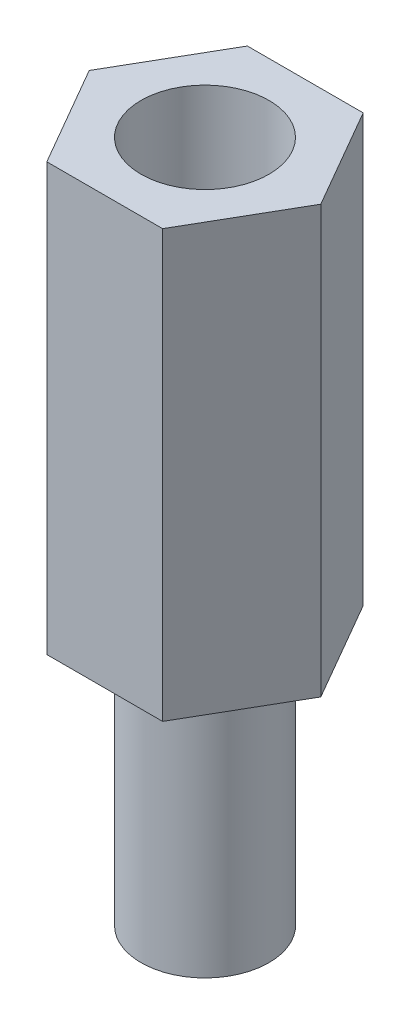
from build123d import *

# Parameters (mm, degrees)
SKETCH_1_R      = 1.5
EXTRUDE_1_DEPTH = 10
SKETCH_2_R      = 1.5
EXTRUDE_2_DEPTH = 6


with BuildPart() as part:
    # 草图1 → 凸台-拉伸1 (new body)
    with BuildSketch(Plane(origin=(0, 0, 0), x_dir=(1, 0, 0), z_dir=(0, 1, 0))):
        Polygon((2.713546265, 0), (1.356773133, 2.35), (-1.356773133, 2.35), (-2.713546265, 0), (-1.356773133, -2.35), (1.356773133, -2.35), align=None)
        with Locations(Location((0, 0, 0), (0, 0, 270))):
            Circle(SKETCH_1_R, mode=Mode.SUBTRACT)
    extrude(amount=EXTRUDE_1_DEPTH)


with BuildPart() as body_2:
    # 草图2 → 凸台-拉伸2 (new body)
    with BuildSketch(Plane(origin=(0, 0, 0), x_dir=(-1, 0, 0), z_dir=(0, -1, 0))):
        with Locations(Location((0, 0, 0), (0, 0, 90))):
            Circle(SKETCH_2_R)
    extrude(amount=EXTRUDE_2_DEPTH)


solid = Compound([part.part, body_2.part])
